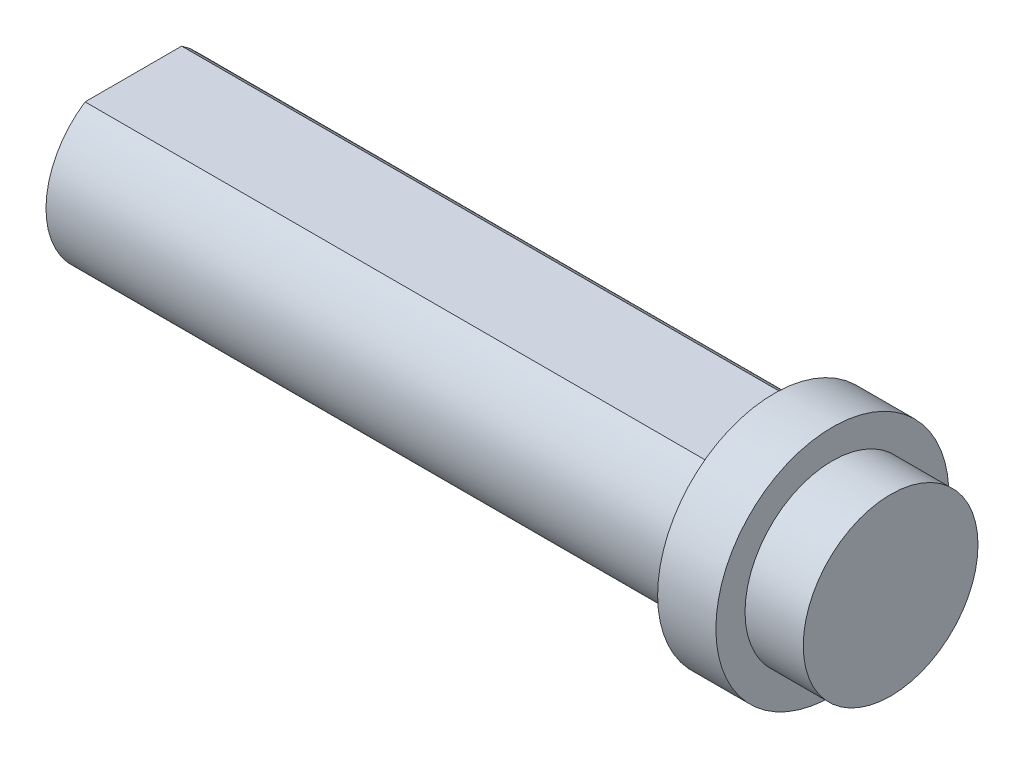
from build123d import *

# Parameters (mm, degrees)
SKETCH1_R           = 3
BOSS_EXTRUDE1_DEPTH = 26
CUT_EXTRUDE1_DEPTH  = 22
SKETCH3_R           = 4
SKETCH3_R_2         = 3
BOSS_EXTRUDE2_DEPTH = 2
BOSS_EXTRUDE3_DEPTH = 1.66


with BuildPart() as part:
    # Sketch1 → Boss-Extrude1 (new body)
    with BuildSketch(Plane(origin=(0, 0, 0), x_dir=(0, 0, -1), z_dir=(1, 0, 0))):
        with Locations(Location((0, 0, 0), (0, 0, 180))):
            Circle(SKETCH1_R)
    extrude(amount=BOSS_EXTRUDE1_DEPTH)

    # Sketch2 → Cut-Extrude1 (cut)
    with BuildSketch(Plane.ZY):
        with BuildLine():
            Line((-1.658312395, 2.5), (1.658312395, 2.5))
            ThreePointArc((1.658312395, 2.5), (0, 3), (-1.658312395, 2.5))
        make_face()
    extrude(amount=-CUT_EXTRUDE1_DEPTH, mode=Mode.SUBTRACT)

    # Sketch3 → Boss-Extrude2 (add)
    with BuildSketch(Plane.ZY.offset(-22)):
        Circle(SKETCH3_R)
        Circle(SKETCH3_R_2, mode=Mode.SUBTRACT)
    extrude(amount=-BOSS_EXTRUDE2_DEPTH)

    # Sketch4 → Boss-Extrude3 (add, symmetric)
    with BuildSketch(Plane.XY):
        Polygon((21.5, 2.5), (22, 2.75), (22, 2.5), align=None)
    extrude(amount=BOSS_EXTRUDE3_DEPTH, both=True)


solid = part.part
